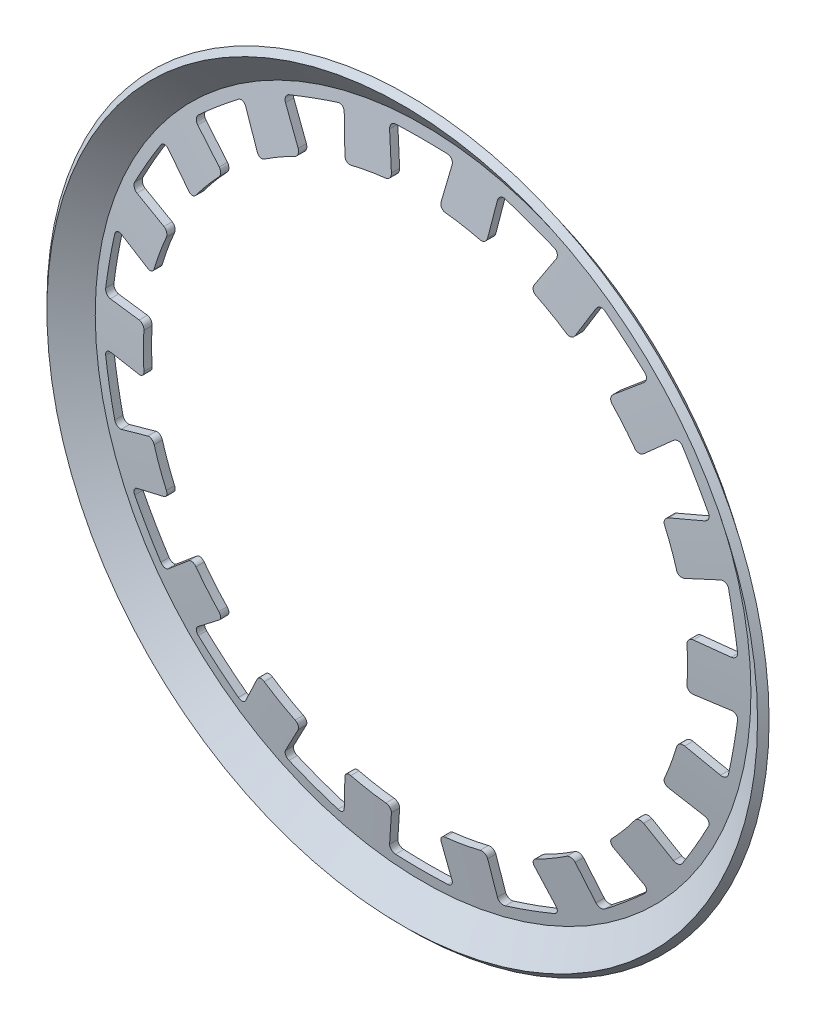
from build123d import *

# Parameters (mm, degrees)
CUT_EXTRUDE1_DEPTH       = 24.843464481
FILLET1_R                = 0.254
CIRPATTERN1_COUNT        = 18
FILLET1_OF_CIRPATTERN1_R = 0.254


with BuildPart() as part:
    # Sketch4 → Revolve1 (revolve)
    with BuildSketch(Plane(origin=(0, 0, 0), x_dir=(1, 0, 0), z_dir=(0, 1, 0)), mode=Mode.PRIVATE) as revolve1_sk:
        Polygon((-16.8529, -0.416392316), (-16.583492316, -0.6858), (-15.300821862, 0.287573594), (-11.813702447, -0.1905), (0, -0.1905), (0, 0.1905), (-11.787707051, 0.1905), (-15.400477695, 0.6858), align=None)
    revolve(revolve1_sk.sketch.rotate(Axis((0, 0, 0.1905), (0, 0, -1)), 180), axis=Axis((0, 0, 0.1905), (0, 0, -1)))

    # Sketch5 → Cut-Extrude1 (cut, symmetric)
    with BuildSketch(Plane.XY):
        with BuildLine():
            Line((-1.51359118, 14.744030936), (-1.106877933, 12.651672666))
            ThreePointArc((-1.106877933, 12.651672666), (-1.657682641, 12.591349739), (-2.205331856, 12.507058463))
            Line((-2.205331856, 12.507058463), (0, 0))
            Line((0, 0), (2.205331856, 12.507058463))
            ThreePointArc((2.205331856, 12.507058463), (1.657682641, 12.591349739), (1.106877933, 12.651672666))
            Line((1.106877933, 12.651672666), (1.51359118, 14.744030936))
            ThreePointArc((1.51359118, 14.744030936), (0, 14.7828), (-1.51359118, 14.744030936))
        make_face()
    cut_extrude1 = extrude(amount=CUT_EXTRUDE1_DEPTH, both=True, mode=Mode.SUBTRACT)

    # Fillet1
    fillet1_edges = [part.edges().sort_by_distance(p)[0] for p in [
        (1.106877933, 12.651672666, -0.123290677),
        (-1.106877933, 12.651672666, -0.123290677),
        (1.51359118, 14.744030936, -0.414144469),
        (-1.51359118, 14.744030936, -0.414144469),
    ]]
    fillet(fillet1_edges, radius=FILLET1_R)

    # CirPattern1: Cut-Extrude1 ×18 about axis
    cirpattern1_axis = Axis((0, 0, 0), (0, 0, 1))
    for i in range(1, CIRPATTERN1_COUNT):
        add(cut_extrude1.rotate(cirpattern1_axis, i * 360 / CIRPATTERN1_COUNT), mode=Mode.SUBTRACT)

    # Fillet1 of CirPattern1
    fillet1_of_cirpattern1_edges = [part.edges().sort_by_distance(p)[0] for p in [
        (-3.287001873, 12.267257994, -0.123290677),
        (-5.367251924, 11.510108895, -0.123290677),
        (-3.620445111, 14.372535743, -0.414144469),
        (-6.465066037, 13.337178398, -0.414144469),
        (-7.284420742, 10.403230962, -0.123290677),
        (-8.980256121, 8.980256121, -0.123290677),
        (-8.317802289, 12.267500624, -0.414144469),
        (-10.636758515, 10.321665311, -0.414144469),
        (-10.403230962, 7.284420742, -0.123290677),
        (-11.510108895, 5.367251924, -0.123290677),
        (-12.011909754, 8.682823881, -0.414144469),
        (-13.525500935, 6.061207055, -0.414144469),
        (-12.267257994, 3.287001873, -0.123290677),
        (-12.651672666, 1.106877933, -0.123290677),
        (-14.257203626, 4.050870433, -0.414144469),
        (-14.782868326, 1.069677774, -0.414144469),
        (-12.651672666, -1.106877933, -0.123290677),
        (-12.267257994, -3.287001873, -0.123290677),
        (-14.782868326, -1.069677774, -0.414144469),
        (-14.257203626, -4.050870433, -0.414144469),
        (-11.510108895, -5.367251924, -0.123290677),
        (-10.403230962, -7.284420742, -0.123290677),
        (-13.525500935, -6.061207055, -0.414144469),
        (-12.011909754, -8.682823881, -0.414144469),
        (-8.980256121, -8.980256121, -0.123290677),
        (-7.284420742, -10.403230962, -0.123290677),
        (-10.636758515, -10.321665311, -0.414144469),
        (-8.317802289, -12.267500624, -0.414144469),
        (-5.367251924, -11.510108895, -0.123290677),
        (-3.287001873, -12.267257994, -0.123290677),
        (-6.465066037, -13.337178398, -0.414144469),
        (-3.620445111, -14.372535743, -0.414144469),
        (-1.106877933, -12.651672666, -0.123290677),
        (1.106877933, -12.651672666, -0.123290677),
        (-1.51359118, -14.744030936, -0.414144469),
        (1.51359118, -14.744030936, -0.414144469),
        (3.287001873, -12.267257994, -0.123290677),
        (5.367251924, -11.510108895, -0.123290677),
        (3.620445111, -14.372535743, -0.414144469),
        (6.465066037, -13.337178398, -0.414144469),
        (7.284420742, -10.403230962, -0.123290677),
        (8.980256121, -8.980256121, -0.123290677),
        (8.317802289, -12.267500624, -0.414144469),
        (10.636758515, -10.321665311, -0.414144469),
        (10.403230962, -7.284420742, -0.123290677),
        (11.510108895, -5.367251924, -0.123290677),
        (12.011909754, -8.682823881, -0.414144469),
        (13.525500935, -6.061207055, -0.414144469),
        (12.267257994, -3.287001873, -0.123290677),
        (12.651672666, -1.106877933, -0.123290677),
        (14.257203626, -4.050870433, -0.414144469),
        (14.782868326, -1.069677774, -0.414144469),
        (12.651672666, 1.106877933, -0.123290677),
        (12.267257994, 3.287001873, -0.123290677),
        (14.782868326, 1.069677774, -0.414144469),
        (14.257203626, 4.050870433, -0.414144469),
        (11.510108895, 5.367251924, -0.123290677),
        (10.403230962, 7.284420742, -0.123290677),
        (13.525500935, 6.061207055, -0.414144469),
        (12.011909754, 8.682823881, -0.414144469),
        (8.980256121, 8.980256121, -0.123290677),
        (7.284420742, 10.403230962, -0.123290677),
        (10.636758515, 10.321665311, -0.414144469),
        (8.317802289, 12.267500624, -0.414144469),
        (5.367251924, 11.510108895, -0.123290677),
        (3.287001873, 12.267257994, -0.123290677),
        (6.465066037, 13.337178398, -0.414144469),
        (3.620445111, 14.372535743, -0.414144469),
    ]]
    fillet(fillet1_of_cirpattern1_edges, radius=FILLET1_OF_CIRPATTERN1_R)


solid = part.part
